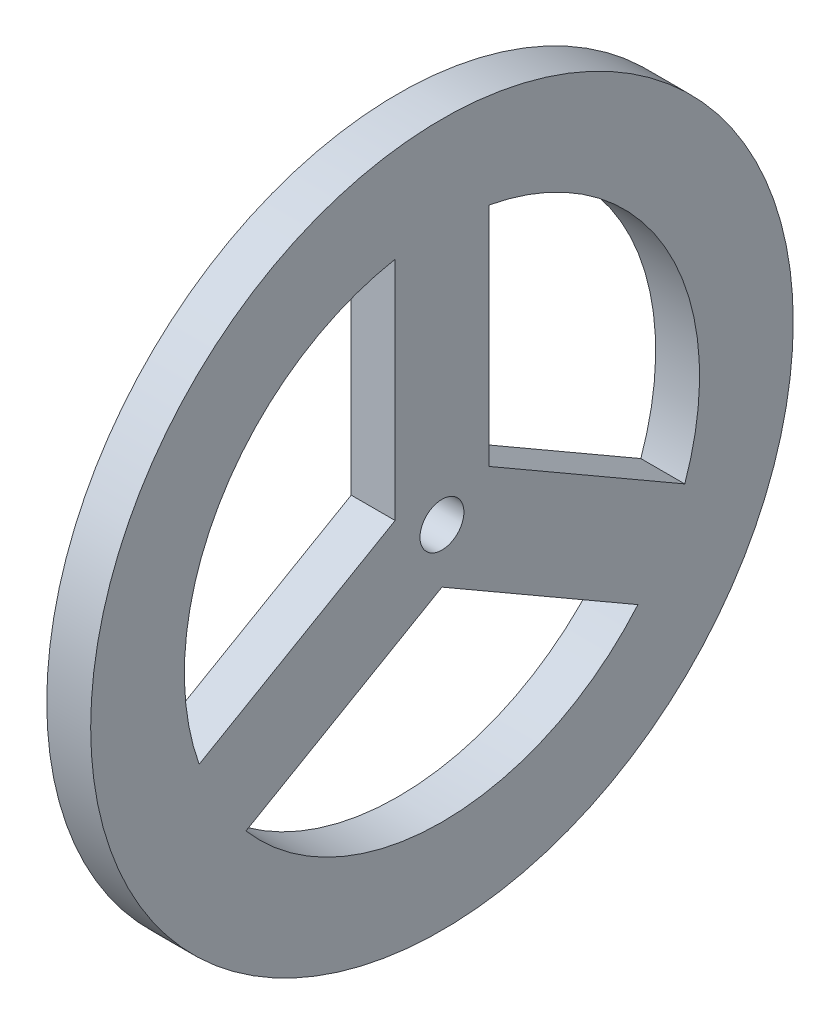
from build123d import *

# Parameters (mm, degrees)
SKETCH2_R           = 38.1
BOSS_EXTRUDE5_DEPTH = 4.7625
SKETCH2_3_R         = 2.38125
CUT_EXTRUDE3_DEPTH  = 55.091601994


with BuildPart() as part:
    # Sketch2 → Boss-Extrude5 (new body)
    with BuildSketch(Plane(origin=(0, 0, 0), x_dir=(0, 0, -1), z_dir=(1, 0, 0))):
        Circle(SKETCH2_R)
    extrude(amount=BOSS_EXTRUDE5_DEPTH)

    # Sketch2<3> → Cut-Extrude3 (cut, through all)
    with BuildSketch(Plane(origin=(0, 0, 0), x_dir=(0, 0, -1), z_dir=(1, 0, 0))):
        with BuildLine():
            Line((21.253442374, -18.136559411), (0, -5.865878735))
            Line((0, -5.865878735), (-21.253442374, -18.136559411))
            ThreePointArc((-21.253442374, -18.136559411), (0, -27.94), (21.253442374, -18.136559411))
        make_face()
        with BuildLine():
            Line((-26.333442374, -9.337741308), (-5.08, 2.932939367))
            Line((-5.08, 2.932939367), (-5.08, 27.474300719))
            ThreePointArc((-5.08, 27.474300719), (-24.196749782, 13.97), (-26.333442374, -9.337741308))
        make_face()
        with BuildLine():
            Line((5.08, 2.932939367), (26.333442374, -9.337741308))
            ThreePointArc((26.333442374, -9.337741308), (24.196749782, 13.97), (5.08, 27.474300719))
            Line((5.08, 27.474300719), (5.08, 2.932939367))
        make_face()
        Circle(SKETCH2_3_R)
    extrude(amount=CUT_EXTRUDE3_DEPTH, mode=Mode.SUBTRACT)


solid = part.part
